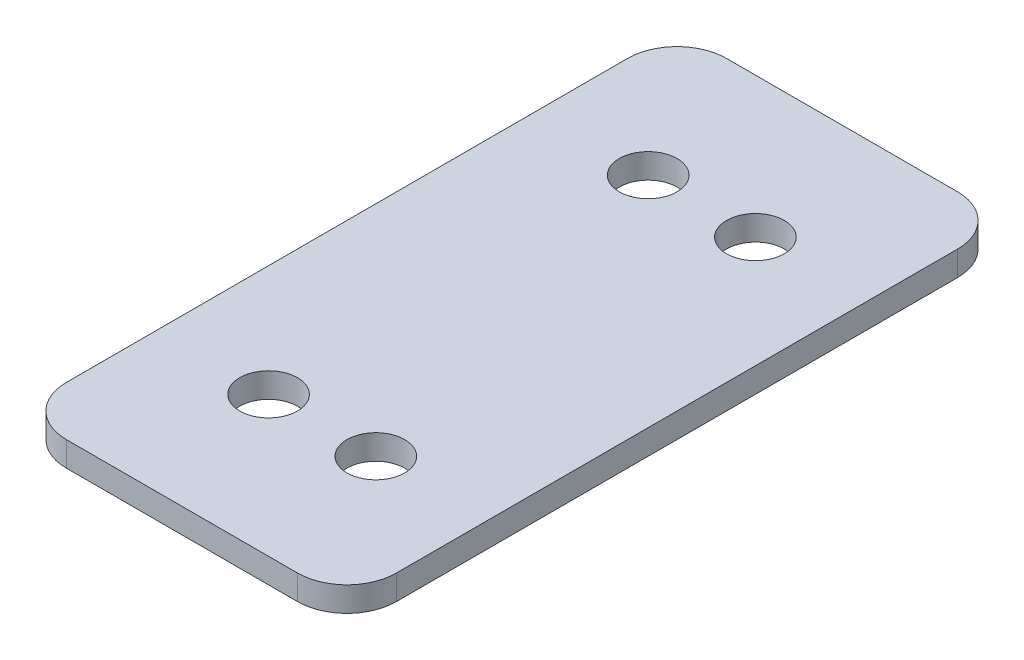
from build123d import *

# Parameters (mm, degrees)
SKIZZE1_W                       = 40
SKIZZE1_H                       = 3
AUFSATZ_LINEAR_AUSTRAGEN1_DEPTH = 40
VERRUNDUNG1_R                   = 6
SKIZZE2_R                       = 3.5
SCHNITT_LINEAR_AUSTRAGEN1_DEPTH = 10


with BuildPart() as part:
    # Skizze1 → Aufsatz-Linear austragen1 (new, symmetric)
    with BuildSketch(Plane.XY):
        with Locations((0, -1.5)):
            Rectangle(SKIZZE1_W, SKIZZE1_H)
    extrude(amount=AUFSATZ_LINEAR_AUSTRAGEN1_DEPTH, both=True)

    # Verrundung1
    verrundung1_edges = [part.edges().sort_by_distance(p)[0] for p in [
        (20, -1.5, 40),
        (-20, -1.5, 40),
        (20, -1.5, -40),
        (-20, -1.5, -40),
    ]]
    fillet(verrundung1_edges, radius=VERRUNDUNG1_R)

    # Skizze2 → Schnitt-Linear austragen1 (cut)
    with BuildSketch(Plane(origin=(0, 0, 0), x_dir=(1, 0, 0), z_dir=(0, 1, 0))):
        with Locations(Location((6.5, 23, 0), (0, 0, 270))):
            Circle(SKIZZE2_R)
        with Locations(Location((-6.5, 23, 0), (0, 0, 270))):
            Circle(SKIZZE2_R)
        with Locations(Location((6.5, -23, 0), (0, 0, 270))):
            Circle(SKIZZE2_R)
        with Locations(Location((-6.5, -23, 0), (0, 0, 270))):
            Circle(SKIZZE2_R)
    extrude(amount=-SCHNITT_LINEAR_AUSTRAGEN1_DEPTH, mode=Mode.SUBTRACT)


solid = part.part
